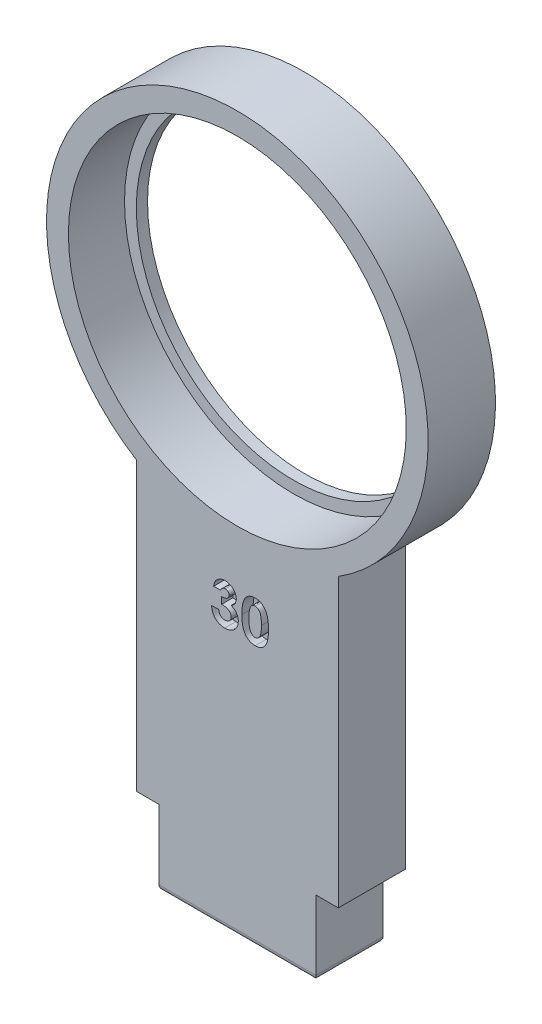
from build123d import *

# Parameters (mm, degrees)
SKETCH1_R           = 17
BOSS_EXTRUDE1_DEPTH = 3
SKETCH2_R           = 15.05
CUT_EXTRUDE1_DEPTH  = 5
SKETCH3_R           = 14
CUT_EXTRUDE2_DEPTH  = 25.556058316
BOSS_EXTRUDE2_DEPTH = 3
SKETCH5_W           = 14
SKETCH5_H           = 6.7
BOSS_EXTRUDE3_DEPTH = 3
CUT_EXTRUDE3_DEPTH  = 1
FILLET1_R           = 0.5


with BuildPart() as part:
    # Sketch1 → Boss-Extrude1 (new, symmetric)
    with BuildSketch(Plane.XY):
        Circle(SKETCH1_R)
    extrude(amount=BOSS_EXTRUDE1_DEPTH, both=True)

    # Sketch2 → Cut-Extrude1 (cut)
    with BuildSketch(Plane.XY.offset(3)):
        Circle(SKETCH2_R)
    extrude(amount=-CUT_EXTRUDE1_DEPTH, mode=Mode.SUBTRACT)

    # Sketch3 → Cut-Extrude2 (cut, through all)
    with BuildSketch(Plane.XY.offset(-2)):
        Circle(SKETCH3_R)
    extrude(amount=-CUT_EXTRUDE2_DEPTH, mode=Mode.SUBTRACT)

    # Sketch4 → Boss-Extrude2 (add, symmetric)
    with BuildSketch(Plane.XY):
        with BuildLine():
            Line((-9, -14.422205102), (-9, -40))
            Line((-9, -40), (9, -40))
            Line((9, -40), (9, -14.422205102))
            ThreePointArc((9, -14.422205102), (0, -17), (-9, -14.422205102))
        make_face()
    extrude(amount=BOSS_EXTRUDE2_DEPTH, both=True)

    # Sketch5 → Boss-Extrude3 (add, symmetric)
    with BuildSketch(Plane.XY):
        with Locations((0, -43.35)):
            Rectangle(SKETCH5_W, SKETCH5_H)
    extrude(amount=BOSS_EXTRUDE3_DEPTH, both=True)

    # Sketch6 → Cut-Extrude3 (cut)
    # profile 1 of 2: a face of its own
    with BuildSketch(Plane.XY.offset(3)):
        with BuildLine():
            Line((-1.483990781, -20.733258482), (-2.112195909, -20.733258482))
            add(Edge.make_bspline(
                [(-2.112195909, -20.733258482), (-2.107760542, -20.701856749), (-2.099065299, -20.640295731), (-2.078258744, -20.551170712), (-2.053371859, -20.466629533), (-2.022301855, -20.386939917), (-1.985861796, -20.311959911), (-1.944422234, -20.241432221), (-1.897535194, -20.175659563), (-1.861595782, -20.136037854), (-1.843666262, -20.116271302)],
                knots=[0, 0, 0, 0, 1.111473889, 2.178970933, 3.205615836, 4.199322666, 5.174200091, 6.12565194, 7.064921805, 8, 8, 8, 8], degree=3))
            add(Edge.make_bspline(
                [(-1.843666262, -20.116271302), (-1.817805305, -20.09019077), (-1.766836077, -20.038788783), (-1.681660519, -19.972948514), (-1.592380804, -19.91596824), (-1.497206388, -19.870793866), (-1.397618258, -19.834230443), (-1.292824453, -19.80967071), (-1.1832532, -19.79337511), (-1.108484604, -19.791769937), (-1.070328922, -19.79095079)],
                knots=[0, 0, 0, 0, 1.01925491, 2.00884431, 2.983262333, 3.955970413, 4.92937149, 5.924503185, 6.940838805, 8, 8, 8, 8], degree=3))
            add(Edge.make_bspline(
                [(-1.070328922, -19.79095079), (-1.036406558, -19.79175163), (-0.969722025, -19.793325921), (-0.871712542, -19.805963476), (-0.778268701, -19.82812834), (-0.688402775, -19.857108403), (-0.603436398, -19.896540621), (-0.52149428, -19.942313034), (-0.444865887, -19.9984548), (-0.373371923, -20.061889346), (-0.307691081, -20.130500017), (-0.250811184, -20.203839183), (-0.201910516, -20.279947784), (-0.161622834, -20.359458139), (-0.130647081, -20.442504789), (-0.10914899, -20.528607986), (-0.095077967, -20.617577735), (-0.093676126, -20.678049275), (-0.09296514, -20.708719219)],
                knots=[0, 0, 0, 0, 1.091422571, 2.145516843, 3.172569842, 4.178562979, 5.178154469, 6.181868002, 7.194278174, 8.227918432, 9.254613415, 10.245994977, 11.209837596, 12.161663635, 13.10878368, 14.055455738, 15.013766427, 16, 16, 16, 16], degree=3))
            add(Edge.make_bspline(
                [(-0.09296514, -20.708719219), (-0.094424125, -20.746701391), (-0.097296418, -20.821476609), (-0.120865664, -20.930915696), (-0.157757942, -21.035558994), (-0.211052426, -21.133942385), (-0.277684105, -21.225798124), (-0.359438943, -21.3080552), (-0.453988352, -21.382003291), (-0.524967852, -21.421743004), (-0.561314499, -21.442092616)],
                knots=[0, 0, 0, 0, 0.992805628, 1.954529043, 2.915727527, 3.886831945, 4.871318353, 5.87440735, 6.911542536, 8, 8, 8, 8], degree=3))
            add(Edge.make_bspline(
                [(-0.561314499, -21.442092616), (-0.536366718, -21.450283498), (-0.487345447, -21.466378214), (-0.417667604, -21.498076574), (-0.351411937, -21.532717627), (-0.289719346, -21.572961399), (-0.231976222, -21.617180611), (-0.178534575, -21.665753263), (-0.129075102, -21.718573446), (-0.084405211, -21.775931649), (-0.044758937, -21.83691054), (-0.009186446, -21.900101544), (0.020091696, -21.966462962), (0.044893928, -22.035236902), (0.063776936, -22.10704147), (0.07707226, -22.181598427), (0.084757284, -22.258737704), (0.085929381, -22.310999518), (0.086522039, -22.337425149)],
                knots=[0, 0, 0, 0, 1.059543567, 2.081955587, 3.086750234, 4.076226789, 5.052108497, 6.020845489, 6.989030705, 7.970690546, 8.952259656, 9.923888338, 10.895517021, 11.877585046, 12.873342345, 13.889638361, 14.932918083, 16, 16, 16, 16], degree=3))
            add(Edge.make_bspline(
                [(0.086522039, -22.337425149), (0.085320641, -22.376260096), (0.082951728, -22.452834703), (0.067891288, -22.565621263), (0.039851463, -22.673153227), (0.00296352, -22.776667914), (-0.046240993, -22.874828985), (-0.104146432, -22.969889104), (-0.175323852, -23.058551611), (-0.254425332, -23.143160515), (-0.342272137, -23.220083142), (-0.437512365, -23.286771598), (-0.538051765, -23.344002158), (-0.644526421, -23.390463558), (-0.756899342, -23.426244149), (-0.874920058, -23.45210801), (-0.999084459, -23.467931948), (-1.083836378, -23.469590788), (-1.127119787, -23.470437969)],
                knots=[0, 0, 0, 0, 1.005138573, 1.981928558, 2.936866704, 3.876260664, 4.820238198, 5.773547, 6.751179199, 7.756627054, 8.768222608, 9.766606018, 10.760583154, 11.757261445, 12.767156078, 13.807575856, 14.880313354, 16, 16, 16, 16], degree=3))
            add(Edge.make_bspline(
                [(-1.127119787, -23.470437969), (-1.168065195, -23.46954476), (-1.24812852, -23.467798207), (-1.36523789, -23.452680905), (-1.476539261, -23.428295472), (-1.582316675, -23.393922181), (-1.68216089, -23.349345897), (-1.77697733, -23.296265545), (-1.864873955, -23.231619573), (-1.946830106, -23.158326223), (-2.021027748, -23.076095245), (-2.087342967, -22.986831481), (-2.144313501, -22.890195495), (-2.192172986, -22.786600157), (-2.23054727, -22.675863731), (-2.260816792, -22.558211404), (-2.281960549, -22.433413319), (-2.288399924, -22.347549582), (-2.291683089, -22.303771302)],
                knots=[0, 0, 0, 0, 1.066544725, 2.085487077, 3.070979577, 4.031932826, 4.977951092, 5.916076795, 6.857635327, 7.814973522, 8.776389752, 9.738577119, 10.707772778, 11.69409279, 12.707140348, 13.757286496, 14.856535458, 16, 16, 16, 16], degree=3))
            Line((-2.291683089, -22.303771302), (-1.663477961, -22.303771302))
            add(Edge.make_bspline(
                [(-1.663477961, -22.303771302), (-1.65949709, -22.325783596), (-1.651743301, -22.368658311), (-1.636620011, -22.430731366), (-1.616912254, -22.48802863), (-1.594125184, -22.541059359), (-1.569511718, -22.590519829), (-1.539772764, -22.634583341), (-1.507087439, -22.674446401), (-1.459922275, -22.721836046), (-1.392496425, -22.770526928), (-1.30144919, -22.81284162), (-1.200167762, -22.837643229), (-1.129361944, -22.840668949), (-1.092764819, -22.842232841)],
                knots=[0, 0, 0, 0, 0.928156231, 1.807827665, 2.648129825, 3.438902246, 4.202261636, 4.936546065, 5.639352463, 6.338805438, 7.70633318, 9.064371875, 10.482673459, 12, 12, 12, 12], degree=3))
            add(Edge.make_bspline(
                [(-1.092764819, -22.842232841), (-1.073345092, -22.841899825), (-1.035306189, -22.841247521), (-0.979432706, -22.834017604), (-0.926205346, -22.822109927), (-0.875524971, -22.805927834), (-0.827068946, -22.78564257), (-0.781763072, -22.759485935), (-0.738683903, -22.729075113), (-0.698299747, -22.694885275), (-0.660983955, -22.657630592), (-0.629935022, -22.616377359), (-0.601558543, -22.574456701), (-0.580571095, -22.529126022), (-0.56218157, -22.482824594), (-0.55092624, -22.433871823), (-0.542427658, -22.383294605), (-0.541933755, -22.348681778), (-0.541683089, -22.331115052)],
                knots=[0, 0, 0, 0, 1.110435564, 2.175094844, 3.216326037, 4.226890168, 5.215276772, 6.21526065, 7.213097102, 8.228249917, 9.239874822, 10.221364777, 11.178138315, 12.128914389, 13.072518965, 14.022636769, 14.996447288, 16, 16, 16, 16], degree=3))
            add(Edge.make_bspline(
                [(-0.541683089, -22.331115052), (-0.542348561, -22.311902845), (-0.543673363, -22.273655743), (-0.554497134, -22.21784214), (-0.571590157, -22.164153951), (-0.595334454, -22.112828935), (-0.627042316, -22.064056264), (-0.664457239, -22.016857412), (-0.710526902, -21.973688993), (-0.761071491, -21.93101832), (-0.819683358, -21.893822362), (-0.883508023, -21.859495958), (-0.954222896, -21.832182739), (-1.030101766, -21.807786974), (-1.112579951, -21.789968687), (-1.201145292, -21.777030874), (-1.295654921, -21.767400677), (-1.360801636, -21.766019066), (-1.394247191, -21.765309764)],
                knots=[0, 0, 0, 0, 0.809814727, 1.612155564, 2.388397, 3.182215007, 3.988903953, 4.837162975, 5.715530372, 6.646997145, 7.623086902, 8.637258368, 9.698941581, 10.815059213, 11.996518529, 13.252603015, 14.589518788, 16, 16, 16, 16], degree=3))
            Line((-1.394247191, -21.765309764), (-1.394247191, -21.181976431))
            add(Edge.make_bspline(
                [(-1.394247191, -21.181976431), (-1.352605486, -21.17843009), (-1.274702101, -21.171795588), (-1.166568026, -21.156280576), (-1.075533074, -21.135542207), (-0.999409219, -21.110522488), (-0.936200847, -21.078390651), (-0.880982362, -21.042918521), (-0.83342559, -21.001722826), (-0.793233739, -20.956032016), (-0.761081509, -20.906964372), (-0.738326033, -20.855282548), (-0.723299506, -20.802585645), (-0.721875744, -20.766542551), (-0.721170268, -20.748683161)],
                knots=[0, 0, 0, 0, 1.70044513, 3.18119609, 4.440695891, 5.496282586, 6.431922213, 7.318171381, 8.16090191, 8.983045123, 9.787564368, 10.536848927, 11.275007137, 12, 12, 12, 12], degree=3))
            add(Edge.make_bspline(
                [(-0.721170268, -20.748683161), (-0.722387416, -20.725896519), (-0.72476303, -20.681421817), (-0.743213337, -20.61776915), (-0.77524098, -20.561028073), (-0.818184425, -20.511317985), (-0.870512506, -20.469796395), (-0.93185019, -20.439652428), (-1.000866447, -20.421941501), (-1.049423102, -20.420105475), (-1.074535653, -20.419155918)],
                knots=[0, 0, 0, 0, 1.009664648, 1.970651636, 2.907870547, 3.878035693, 4.867062054, 5.849714035, 6.887914197, 8, 8, 8, 8], degree=3))
            add(Edge.make_bspline(
                [(-1.074535653, -20.419155918), (-1.097297357, -20.420276295), (-1.14246355, -20.422499467), (-1.208510042, -20.439092631), (-1.271232206, -20.467025157), (-1.329331242, -20.505542465), (-1.381968478, -20.551800119), (-1.425168462, -20.606582709), (-1.461100161, -20.666608114), (-1.476330662, -20.710954597), (-1.483990781, -20.733258482)],
                knots=[0, 0, 0, 0, 0.98818071, 1.960853194, 2.938124878, 3.957524365, 4.978590984, 5.968022688, 6.978025184, 8, 8, 8, 8], degree=3))
        make_face()
    # profile 2 of 2: a face of its own
    with BuildSketch(Plane.XY.offset(3)):
        with BuildLine():
            add(Edge.make_bspline(
                [(1.579210341, -19.79095079), (1.609618076, -19.791402201), (1.669407809, -19.792289796), (1.75746683, -19.801903178), (1.842292015, -19.816426316), (1.924215209, -19.83668103), (2.002646721, -19.863487422), (2.078157392, -19.895574214), (2.149848427, -19.934624424), (2.218634115, -19.978733641), (2.284487959, -20.028671529), (2.34582721, -20.085603299), (2.403772051, -20.148218949), (2.457068191, -20.217465116), (2.506895889, -20.292711932), (2.553091418, -20.37397133), (2.595301142, -20.461641018), (2.63399813, -20.555879205), (2.668601099, -20.65809848), (2.697747137, -20.769471343), (2.722744741, -20.890023226), (2.743844483, -21.020054203), (2.759792478, -21.159737116), (2.770541747, -21.308979165), (2.777918405, -21.467492635), (2.778520436, -21.576231573), (2.778829732, -21.632096623)],
                knots=[0, 0, 0, 0, 0.879237366, 1.728815576, 2.559023295, 3.367336655, 4.166867292, 4.954216142, 5.737608147, 6.525189134, 7.316157332, 8.124696809, 8.942788509, 9.781158001, 10.649253743, 11.551476218, 12.482711956, 13.461909668, 14.496590415, 15.601789533, 16.789733467, 18.056700938, 19.410929216, 20.8549011, 22.384193279, 24, 24, 24, 24], degree=3))
            add(Edge.make_bspline(
                [(2.778829732, -21.632096623), (2.778495466, -21.688660607), (2.777845995, -21.798563414), (2.770848397, -21.958526729), (2.758798202, -22.108852365), (2.743267042, -22.249524771), (2.721993601, -22.38046966), (2.697079444, -22.502026091), (2.667473344, -22.614150002), (2.631730565, -22.716588755), (2.593267811, -22.810992444), (2.550942625, -22.898491198), (2.505492731, -22.97932201), (2.457960611, -23.054704325), (2.405740379, -23.122415908), (2.351373742, -23.184759308), (2.29249348, -23.239359786), (2.231578678, -23.289031204), (2.166397782, -23.331957278), (2.097622984, -23.369499714), (2.02402815, -23.399951088), (1.946954788, -23.426436067), (1.865089167, -23.445449425), (1.779732121, -23.460535899), (1.689919985, -23.46887361), (1.628772266, -23.469907958), (1.597439507, -23.470437969)],
                knots=[0, 0, 0, 0, 1.643780988, 3.193836972, 4.651895693, 6.025988579, 7.305620092, 8.505800249, 9.631074763, 10.672816429, 11.65661981, 12.592235626, 13.49536222, 14.350718032, 15.179365177, 15.97804903, 16.751647189, 17.51006938, 18.259804725, 19.016521909, 19.783502495, 20.571750527, 21.382245291, 22.22305063, 23.089471752, 24, 24, 24, 24], degree=3))
            add(Edge.make_bspline(
                [(1.597439507, -23.470437969), (1.566107595, -23.469897734), (1.504728838, -23.468839422), (1.414673841, -23.460597893), (1.328864446, -23.445388309), (1.246351136, -23.426290097), (1.167708193, -23.400009689), (1.092558524, -23.368647231), (1.021479967, -23.331339041), (0.954275716, -23.288312954), (0.891175226, -23.238973875), (0.831197914, -23.183849541), (0.774476455, -23.123079679), (0.721873723, -23.055983614), (0.672528236, -22.983456941), (0.626954591, -22.904671439), (0.585180175, -22.819741818), (0.545898278, -22.728549695), (0.511767282, -22.629131809), (0.48139228, -22.52060037), (0.456509878, -22.402050679), (0.436497785, -22.273520822), (0.420520141, -22.135283094), (0.40863461, -21.987270773), (0.401598144, -21.829414917), (0.400955483, -21.720912725), (0.400624604, -21.665049347)],
                knots=[0, 0, 0, 0, 0.917216111, 1.796812873, 2.643793957, 3.46689424, 4.273913431, 5.068098542, 5.848489301, 6.620921603, 7.401012384, 8.190319798, 9.003608147, 9.831726257, 10.68377682, 11.569763213, 12.493818149, 13.453288342, 14.474581811, 15.568529029, 16.750744269, 18.018426408, 19.375425659, 20.823733699, 22.36466933, 24, 24, 24, 24], degree=3))
            add(Edge.make_bspline(
                [(0.400624604, -21.665049347), (0.401223961, -21.587431582), (0.40238043, -21.437667104), (0.41703605, -21.221300977), (0.438546784, -21.021307973), (0.470140956, -20.838022631), (0.509206713, -20.670766115), (0.559232449, -20.520640223), (0.61618311, -20.385567627), (0.66471239, -20.305549809), (0.688084539, -20.267012488)],
                knots=[0, 0, 0, 0, 1.288568992, 2.486310467, 3.599230591, 4.627010532, 5.572937695, 6.447898582, 7.252493626, 8, 8, 8, 8], degree=3))
            add(Edge.make_bspline(
                [(0.688084539, -20.267012488), (0.715260561, -20.229153437), (0.768395039, -20.155131531), (0.861302159, -20.057954605), (0.961118763, -19.97484414), (1.069895027, -19.907680999), (1.18591061, -19.854716141), (1.310161563, -19.817307658), (1.44218905, -19.795511733), (1.532854527, -19.792493807), (1.579210341, -19.79095079)],
                knots=[0, 0, 0, 0, 1.058512271, 2.069600068, 3.047294572, 4.004278952, 4.967380941, 5.939006123, 6.946246673, 8, 8, 8, 8], degree=3))
        make_face()
        with BuildLine():
            add(Edge.make_bspline(
                [(1.59463502, -20.419155918), (1.567146175, -20.420458834), (1.513253447, -20.423013243), (1.43505253, -20.444696564), (1.361313948, -20.478187623), (1.305222979, -20.518488877), (1.263239446, -20.557122461), (1.23390525, -20.592084599), (1.205617042, -20.631099824), (1.180631472, -20.675928695), (1.157038572, -20.724960455), (1.133981197, -20.778417682), (1.115080204, -20.837613398), (1.096510479, -20.901539494), (1.080241668, -20.971963357), (1.066611971, -21.049460623), (1.054435034, -21.134535265), (1.045941476, -21.227243007), (1.03802293, -21.327486853), (1.032346542, -21.435490109), (1.029973386, -21.551223636), (1.029219033, -21.630927598), (1.028829732, -21.672060565)],
                knots=[0, 0, 0, 0, 1.076674018, 2.110852608, 3.161083442, 4.239746716, 4.804137807, 5.395870207, 6.026861976, 6.692161227, 7.405688833, 8.16177676, 8.973626916, 9.841385931, 10.773283133, 11.807421078, 12.927755683, 14.143907515, 15.458935494, 16.872852025, 18.386167141, 20, 20, 20, 20], degree=3))
            add(Edge.make_bspline(
                [(1.028829732, -21.672060565), (1.029470474, -21.725350312), (1.030699144, -21.827537353), (1.037134343, -21.974485876), (1.050033165, -22.108220864), (1.066076696, -22.22964869), (1.088610491, -22.337981861), (1.11453708, -22.434245309), (1.146554112, -22.517211909), (1.183555962, -22.588081546), (1.224537178, -22.648370198), (1.269024091, -22.699615824), (1.31550208, -22.743992118), (1.365421876, -22.780038435), (1.418664384, -22.807662671), (1.474785127, -22.827532443), (1.533819769, -22.839695558), (1.574246083, -22.841382191), (1.59463502, -22.842232841)],
                knots=[0, 0, 0, 0, 1.771748488, 3.397459088, 4.888034009, 6.237357457, 7.467047327, 8.564189669, 9.548206622, 10.417051504, 11.216568818, 11.965764335, 12.669334354, 13.348544111, 14.005342236, 14.656555988, 15.322436492, 16, 16, 16, 16], degree=3))
            add(Edge.make_bspline(
                [(1.59463502, -22.842232841), (1.614324274, -22.841650763), (1.652873383, -22.840511126), (1.709086619, -22.82881291), (1.762245849, -22.809794152), (1.812190569, -22.782890784), (1.859099424, -22.748679035), (1.902743153, -22.707008564), (1.942792603, -22.657464014), (1.966125595, -22.62069463), (1.978148642, -22.601748065)],
                knots=[0, 0, 0, 0, 0.992283464, 1.942767638, 2.88273346, 3.832339453, 4.79467288, 5.803907806, 6.868395428, 8, 8, 8, 8], degree=3))
            add(Edge.make_bspline(
                [(1.978148642, -22.601748065), (1.992303755, -22.57585819), (2.021985879, -22.521569222), (2.056334085, -22.429958612), (2.08524649, -22.326636985), (2.110130974, -22.211282794), (2.127150443, -22.083441069), (2.141807589, -21.943922465), (2.148877095, -21.792024421), (2.150026989, -21.686788909), (2.150624604, -21.632096623)],
                knots=[0, 0, 0, 0, 0.710965849, 1.490837728, 2.352621235, 3.297892224, 4.334225155, 5.461620853, 6.680770821, 8, 8, 8, 8], degree=3))
            add(Edge.make_bspline(
                [(2.150624604, -21.632096623), (2.150393758, -21.576929581), (2.149949419, -21.470742444), (2.141797092, -21.318298317), (2.130444354, -21.179065907), (2.113838576, -21.053356063), (2.092472223, -20.940863618), (2.066138113, -20.841595925), (2.035092156, -20.755357347), (1.998275352, -20.682233874), (1.957498453, -20.620088954), (1.91421253, -20.566773432), (1.868234552, -20.521253985), (1.81964141, -20.483359315), (1.767308399, -20.454404944), (1.712235146, -20.433960764), (1.654308748, -20.42159272), (1.614794744, -20.419979149), (1.59463502, -20.419155918)],
                knots=[0, 0, 0, 0, 1.793836731, 3.452829483, 4.963243077, 6.335886805, 7.574563692, 8.684454726, 9.672768357, 10.54971625, 11.340229787, 12.085688095, 12.778991901, 13.440269426, 14.083255152, 14.715733572, 15.344777694, 16, 16, 16, 16], degree=3))
        make_face(mode=Mode.SUBTRACT)
    extrude(amount=-CUT_EXTRUDE3_DEPTH, mode=Mode.SUBTRACT)

    # Fillet1
    fillet1_edges = [part.edges().sort_by_distance(p)[0] for p in [
        (0, -46.7, -3),
        (-7, -46.7, 0),
        (7, -46.7, 0),
        (0, -46.7, 3),
    ]]
    fillet(fillet1_edges, radius=FILLET1_R)


solid = part.part
